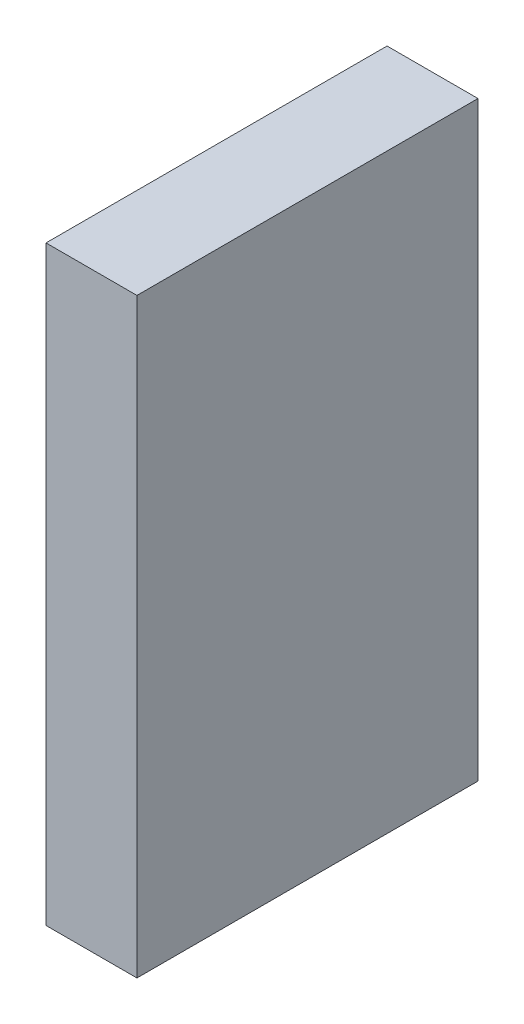
from build123d import *

# Parameters (mm, degrees)
SKETCH_1_W      = 15
SKETCH_1_H      = 26
EXTRUDE_1_DEPTH = 4


with BuildPart() as part:
    # Эскиз1 → Бобышка-Вытянуть1 (new body)
    with BuildSketch(Plane(origin=(0, 0, 0), x_dir=(0, 0, -1), z_dir=(1, 0, 0))):
        with Locations((-27.799281462, 33.180063562)):
            Rectangle(SKETCH_1_W, SKETCH_1_H)
    extrude(amount=EXTRUDE_1_DEPTH)


solid = part.part
